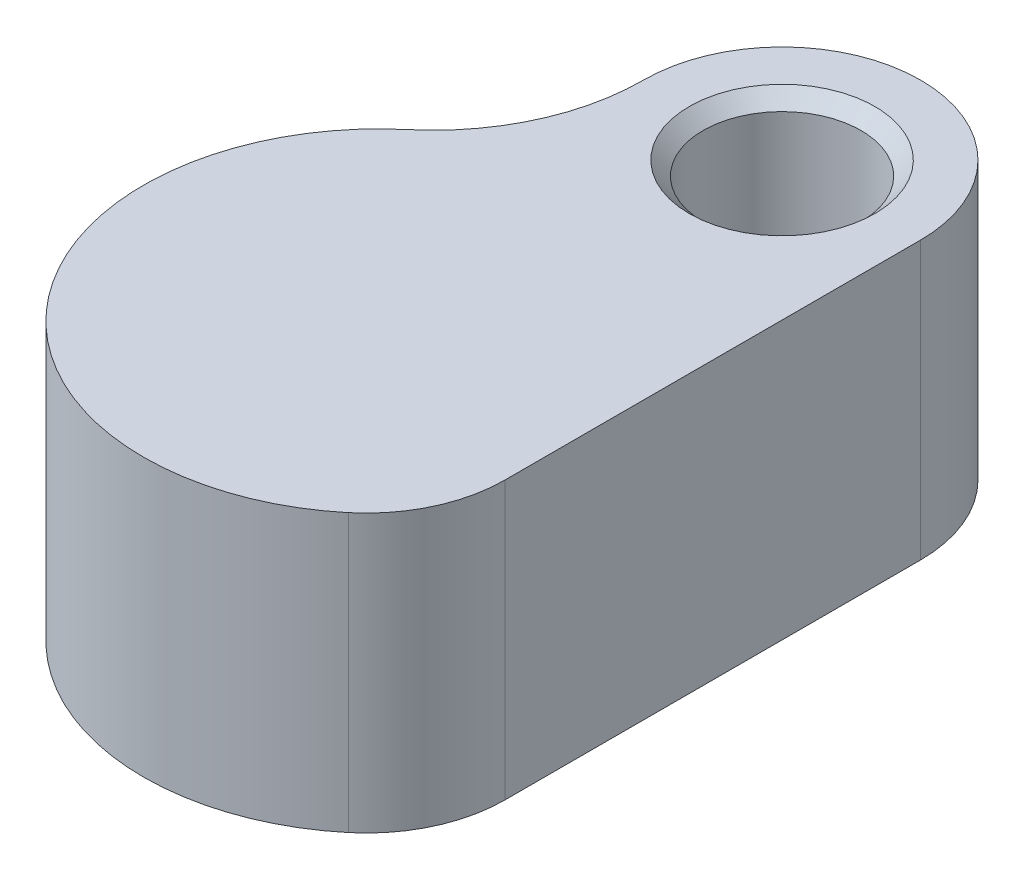
from build123d import *

# Parameters (mm, degrees)
SKETCH2_R           = 2.85
BOSS_EXTRUDE1_DEPTH = 8
CHAMFER1_SIZE       = 0.5
BOSS_EXTRUDE3_START = -2
SKETCH4_R           = 1.6
BOSS_EXTRUDE3_DEPTH = 2


with BuildPart() as part:
    # Sketch2 → Boss-Extrude1 (new body)
    with BuildSketch(Plane(origin=(0, 0, 0), x_dir=(1, 0, 0), z_dir=(0, 1, 0))):
        with BuildLine():
            ThreePointArc((5, 0), (0, 5), (-5, 0))
            ThreePointArc((-5, 0), (-5.709068994, -3.199165875), (-7.703467842, -5.799130177))
            ThreePointArc((-7.703467842, -5.799130177), (-8.760764425, -17.760055771), (3.19780255, -18.843703794))
            ThreePointArc((3.19780255, -18.843703794), (4.527085859, -17.122614809), (5, -15))
            Line((5, -15), (5, 0))
        make_face()
        with Locations(Location((0, 0, 0), (0, 0, 270))):
            Circle(SKETCH2_R, mode=Mode.SUBTRACT)
    extrude(amount=BOSS_EXTRUDE1_DEPTH)

    # Chamfer1
    chamfer1_edges = [part.edges().sort_by_distance(p)[0] for p in [
        (0, 8, -2.85),
    ]]
    chamfer(chamfer1_edges, length=CHAMFER1_SIZE)

    # Sketch4 → Boss-Extrude3 (add)
    with BuildSketch(Plane(origin=(0, 0, 0), x_dir=(1, 0, 0), z_dir=(0, 1, 0)).offset(BOSS_EXTRUDE3_START)):
        with BuildLine():
            Line((5, -15), (5, 0))
            ThreePointArc((5, 0), (0, 5), (-5, 0))
            ThreePointArc((-5, 0), (-5.709068994, -3.199165875), (-7.703467842, -5.799130177))
            ThreePointArc((-7.703467842, -5.799130177), (-8.760764425, -17.760055771), (3.19780255, -18.843703794))
            ThreePointArc((3.19780255, -18.843703794), (4.527085859, -17.122614809), (5, -15))
        make_face()
        with Locations(Location((0, 0, 0), (0, 0, 270))):
            Circle(SKETCH4_R, mode=Mode.SUBTRACT)
    extrude(amount=BOSS_EXTRUDE3_DEPTH)


solid = part.part
